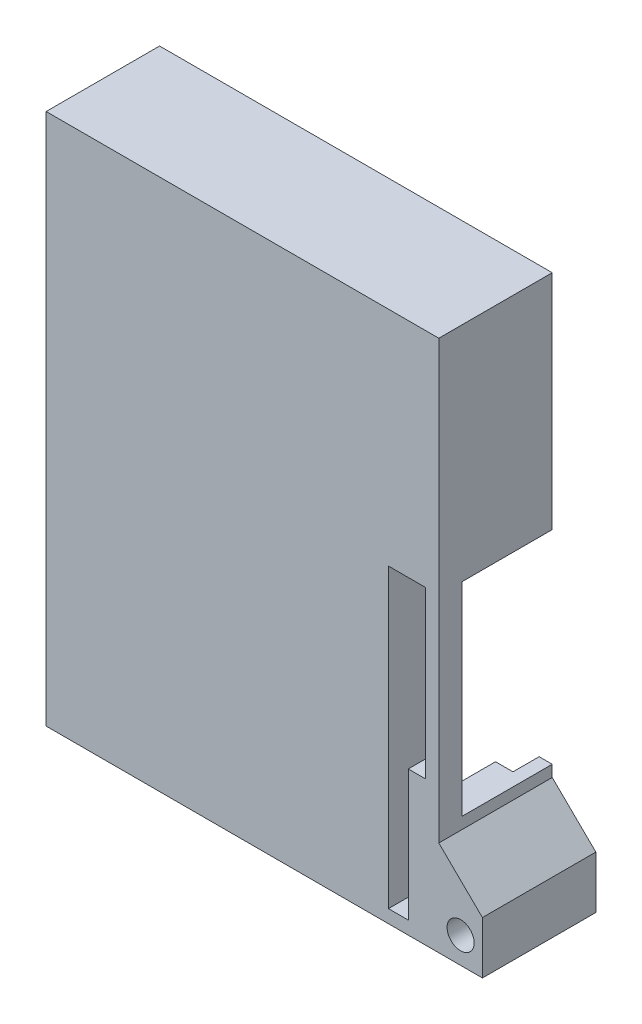
from build123d import *

# Parameters (mm, degrees)
SKETCH_1_W          = 42
SKETCH_1_H          = 58
SKETCH_1_R          = 1.55
EXTRUDE_1_DEPTH     = 13
EXTRUDE_2_DEPTH     = 1
SKETCH_1_4_W        = 11
SKETCH_1_4_H        = 33
EXTRUDE_3_DEPTH     = 4.5
SKETCH_1_5_W        = 14.30710185
SKETCH_1_5_H        = 23
EXTRUDE_4_DEPTH     = 6.5
SKETCH_1_6_W        = 2
SKETCH_1_6_H        = 15
EXTRUDE_5_DEPTH     = 10
SKETCH_1_8_W        = 1.5
SKETCH_1_8_H        = 33
EXTRUDE_6_DEPTH     = 8
SKETCH_2_W          = 10.357609848
SKETCH_2_H          = 23.284426604
CUT_EXTRUDE_1_DEPTH = 2.5


with BuildPart() as part:
    # 草图1 → 凸台-拉伸1 (new body)
    with BuildSketch(Plane.XY):
        Polygon((22.5, -19.601020514), (22.5, 30.5), (-22.5, 30.5), (-22.5, -30.5), (27.5, -30.5), (27.5, -24.5), align=None)
        Rectangle(SKETCH_1_W, SKETCH_1_H, mode=Mode.SUBTRACT)
        with Locations((25, -27.5)):
            Circle(SKETCH_1_R, mode=Mode.SUBTRACT)
    extrude(amount=-EXTRUDE_1_DEPTH)

    # 草图1<3> → 凸台-拉伸2 (add)
    with BuildSketch(Plane.XY):
        Polygon((-21, -29), (4.230409418, -29), (4.230409418, 4), (4.230409418, 29), (-21, 29), align=None)
    extrude(amount=-EXTRUDE_2_DEPTH)

    # 草图1<4> → 凸台-拉伸3 (add)
    with BuildSketch(Plane.XY):
        with Locations((9.730409418, -12.5)):
            Rectangle(SKETCH_1_4_W, SKETCH_1_4_H)
    extrude(amount=-EXTRUDE_3_DEPTH)

    # 草图1<5> → 凸台-拉伸4 (add)
    with BuildSketch(Plane.XY):
        with Locations((13.846449075, 17.5)):
            Rectangle(SKETCH_1_5_W, SKETCH_1_5_H)
    extrude(amount=-EXTRUDE_4_DEPTH)

    # 草图1<6> → 凸台-拉伸5 (add)
    with BuildSketch(Plane.XY):
        with Locations((20, -21.5)):
            Rectangle(SKETCH_1_6_W, SKETCH_1_6_H)
        Polygon((16.730409418, 5), (21, 5), (21, 6), (6.69289815, 6), (6.69289815, 29), (4.230409418, 29), (4.230409418, 4), (16.730409418, 4), align=None)
    extrude(amount=-EXTRUDE_5_DEPTH)

    # 草图1<8> → 凸台-拉伸6 (add)
    with BuildSketch(Plane.XY):
        with Locations((15.980409418, -12.5)):
            Rectangle(SKETCH_1_8_W, SKETCH_1_8_H)
    extrude(amount=-EXTRUDE_6_DEPTH)

    # 草图2 → 切除-拉伸1 (cut, symmetric)
    with BuildSketch(Plane.ZY.offset(-21)):
        with Locations((-7.821195076, -6.642213302)):
            Rectangle(SKETCH_2_W, SKETCH_2_H)
    extrude(amount=CUT_EXTRUDE_1_DEPTH, both=True, mode=Mode.SUBTRACT)


solid = part.part
